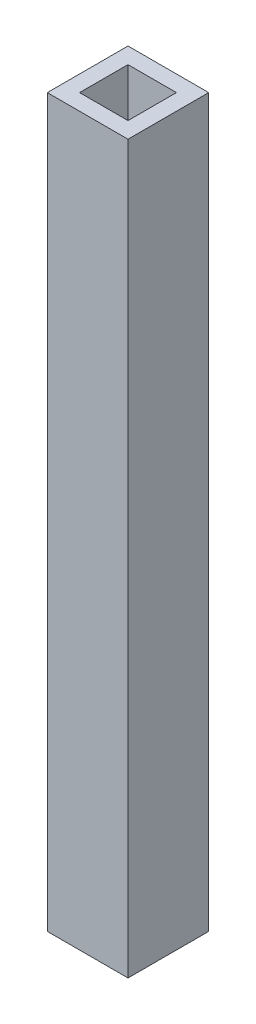
from build123d import *

# Parameters (mm, degrees)
SKETCH1_W           = 10
SKETCH1_H           = 10
SKETCH1_W_2         = 6
SKETCH1_H_2         = 6
EXTRUDE_THIN1_DEPTH = 90


with BuildPart() as part:
    # Sketch1 → Extrude-Thin1 (new body)
    with BuildSketch(Plane(origin=(0, 0, 0), x_dir=(1, 0, 0), z_dir=(0, 1, 0))):
        Rectangle(SKETCH1_W, SKETCH1_H)
        Rectangle(SKETCH1_W_2, SKETCH1_H_2, mode=Mode.SUBTRACT)
    extrude(amount=EXTRUDE_THIN1_DEPTH)


solid = part.part
